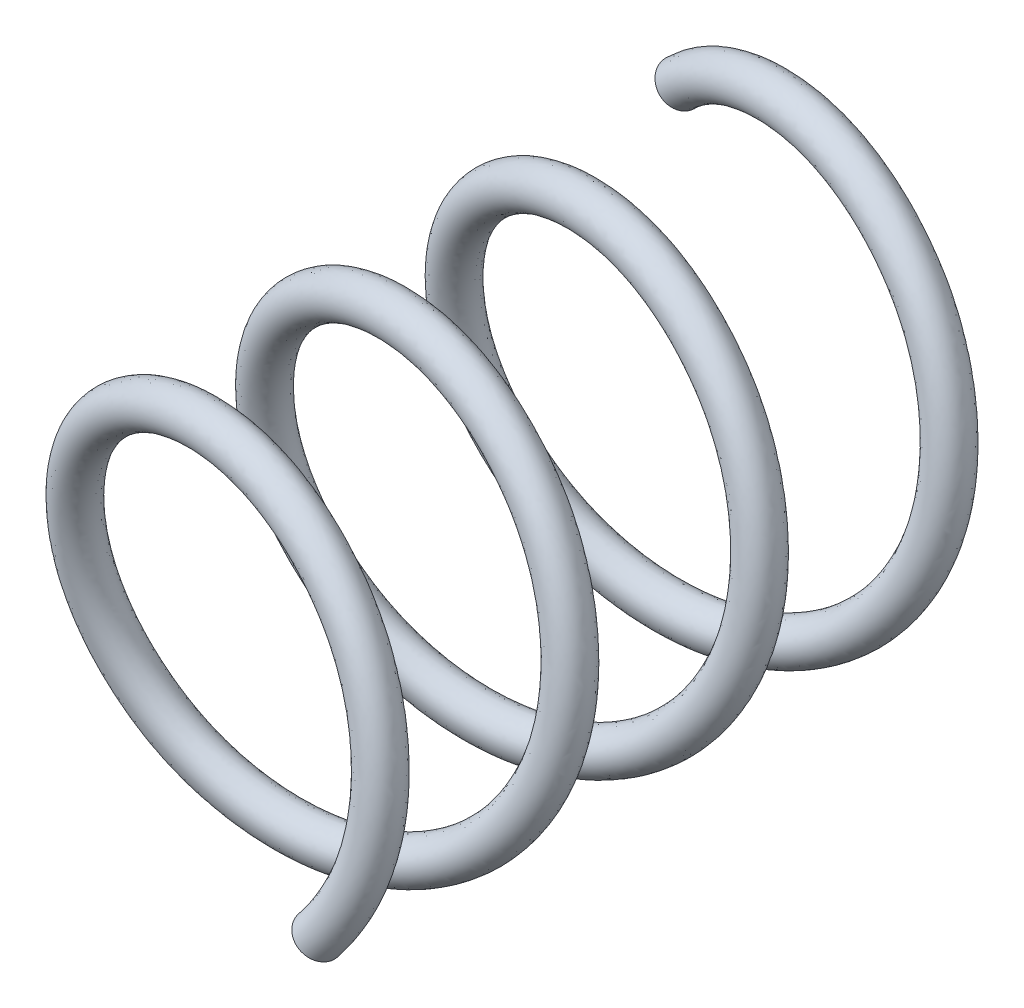
from build123d import *

# Parameters (mm, degrees)
WYCI_GNI_CIE_PO_CIE_CE1_PITCH       = 1.15
WYCI_GNI_CIE_PO_CIE_CE1_HEIGHT      = 4
WYCI_GNI_CIE_PO_CIE_CE1_RADIUS      = 1.2
WYCI_GNI_CIE_PO_CIE_CE1_START_ANGLE = 135
SZKIC2_R                            = 0.125


with BuildPart() as part:
    # Wyciągnięcie po ścieżce1: sweep along a helix
    with BuildLine() as wyci_gni_cie_po_cie_ce1_path:
        add(Helix(WYCI_GNI_CIE_PO_CIE_CE1_PITCH, WYCI_GNI_CIE_PO_CIE_CE1_HEIGHT, WYCI_GNI_CIE_PO_CIE_CE1_RADIUS, center=(0, 0, 0), direction=(0, 0, 1), lefthand=True, mode=Mode.PRIVATE).rotate(Axis((0, 0, 0), (0, 0, 1)), WYCI_GNI_CIE_PO_CIE_CE1_START_ANGLE))
    # Szkic2 → Wyciągnięcie po ścieżce1 (sweep)
    with BuildSketch(Plane(origin=(0, 0, 0), x_dir=(0, 0, -1), z_dir=(1, 0, 0))):
        with Locations((-3.593750599, 1.199924179)):
            Circle(SZKIC2_R)
    sweep(path=wyci_gni_cie_po_cie_ce1_path.line, is_frenet=True)


solid = part.part
